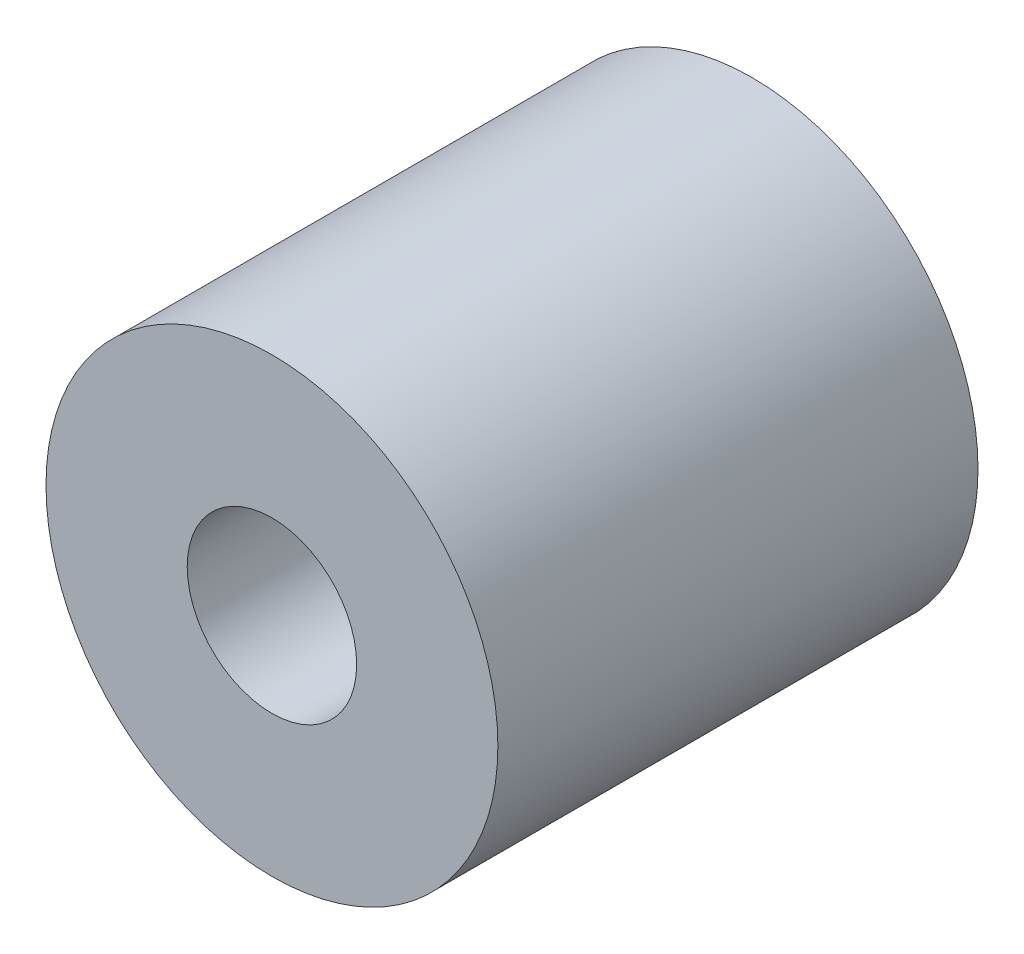
from build123d import *

# Parameters (mm, degrees)
SKETCH1_R           = 4
SKETCH1_R_2         = 3
BOSS_EXTRUDE1_DEPTH = 8.5
BOSS_EXTRUDE2_START = -6
SKETCH2_R           = 3
SKETCH2_R_2         = 1.5
BOSS_EXTRUDE2_DEPTH = 6


with BuildPart() as part:
    # Sketch1 → Boss-Extrude1 (new body)
    with BuildSketch(Plane.XY):
        Circle(SKETCH1_R)
        Circle(SKETCH1_R_2, mode=Mode.SUBTRACT)
    extrude(amount=BOSS_EXTRUDE1_DEPTH)

    # Sketch2 → Boss-Extrude2 (add)
    with BuildSketch(Plane.XY.offset(8.5).offset(BOSS_EXTRUDE2_START)):
        Circle(SKETCH2_R)
        Circle(SKETCH2_R_2, mode=Mode.SUBTRACT)
    extrude(amount=BOSS_EXTRUDE2_DEPTH)


solid = part.part
